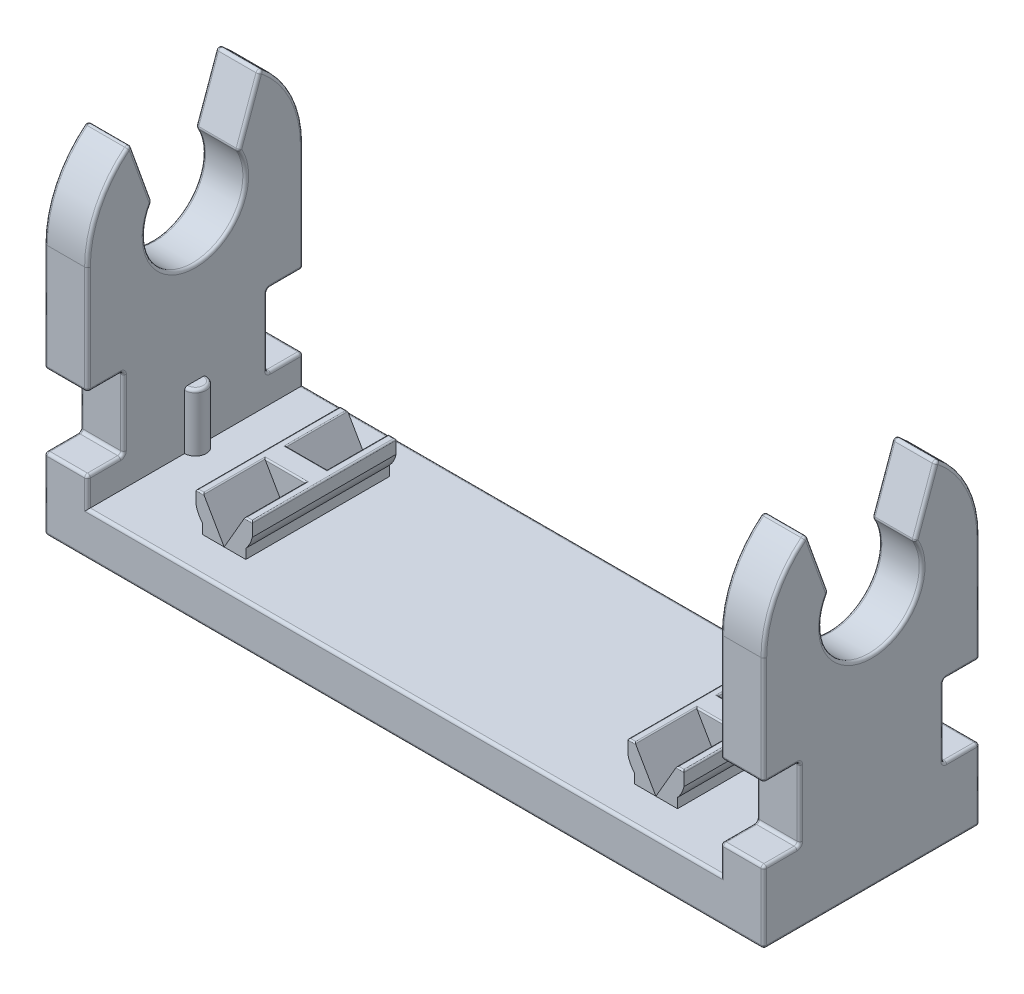
from build123d import *

# Parameters (mm, degrees)
EXTRUDE_1_DEPTH                 = 50
CUT_EXTRUDE_1_REACH             = 57.754
SKETCH_2_W                      = 44
SKETCH_2_H                      = 22
CUT_EXTRUDE_1_DIRECTION_2_REACH = 57.754
EXTRUDE_2_DEPTH                 = 2
PATTERN_LINEAR_1_COUNT          = 2
PATTERN_LINEAR_1_PITCH          = 15
PATTERN_LINEAR_1_COL_COUNT      = 2
PATTERN_LINEAR_1_COL_PITCH      = 15
CUT_EXTRUDE_2_DEPTH             = 50
EXTRUDE_3_DEPTH                 = 5
SKETCH_6_W                      = 2.886751346
SKETCH_6_H                      = 1.5
EXTRUDE_4_DEPTH                 = 2.5
SKETCH_7_R                      = 0.75
EXTRUDE_5_DEPTH                 = 4
PATTERN_LINEAR_2_COUNT          = 2
PATTERN_LINEAR_2_PITCH          = 30
PATTERN_LINEAR_2_COPY_1_DEPTH   = 5
FILLET_1_R                      = 0.1
FILLET_2_R                      = 0.2
FILLET_3_R                      = 0.2
FILLET_4_R                      = 0.1


with BuildPart() as part:
    # 草图1 → 凸台-拉伸1 (new body)
    with BuildSketch(Plane(origin=(0, 0, 0), x_dir=(0, 0, -1), z_dir=(1, 0, 0))):
        with BuildLine():
            Line((7.5, 0), (-7.5, 0))
            Line((-7.5, 0), (-7.5, 5))
            Line((-7.5, 5), (-5, 5))
            Line((-5, 5), (-5, 10))
            Line((-5, 10), (-7.5, 10))
            Line((-7.5, 10), (-7.5, 17.5))
            ThreePointArc((-7.5, 17.5), (-6.708203932, 20.854101966), (-4.5, 23.5))
            Line((-4.5, 23.5), (-3, 19.302775638))
            ThreePointArc((-3, 19.302775638), (0, 14), (3, 19.302775638))
            Line((3, 19.302775638), (4.5, 23.5))
            ThreePointArc((4.5, 23.5), (6.708203932, 20.854101966), (7.5, 17.5))
            Line((7.5, 17.5), (7.5, 10))
            Line((7.5, 10), (5, 10))
            Line((5, 10), (5, 5))
            Line((5, 5), (7.5, 5))
            Line((7.5, 5), (7.5, 0))
        make_face()
    extrude(amount=EXTRUDE_1_DEPTH)

    # 草图2 → 切除-拉伸1 (cut, up to next)
    with BuildSketch(Plane.XY, mode=Mode.PRIVATE) as cut_extrude_1_sk1:
        with Locations((25, 14)):
            Rectangle(SKETCH_2_W, SKETCH_2_H)
    cut_extrude_1_tool1 = extrude(cut_extrude_1_sk1.sketch, amount=-CUT_EXTRUDE_1_REACH, mode=Mode.PRIVATE) & part.part
    add(cut_extrude_1_tool1.solids().sort_by_distance((25, 14, 0))[0], mode=Mode.SUBTRACT)

    # 草图2 → 切除-拉伸1 direction 2 (cut, up to next)
    with BuildSketch(Plane.XY, mode=Mode.PRIVATE) as cut_extrude_1_direction_2_sk1:
        with Locations((25, 14)):
            Rectangle(SKETCH_2_W, SKETCH_2_H)
    cut_extrude_1_direction_2_tool1 = extrude(cut_extrude_1_direction_2_sk1.sketch, amount=CUT_EXTRUDE_1_DIRECTION_2_REACH, mode=Mode.PRIVATE) & part.part
    add(cut_extrude_1_direction_2_tool1.solids().sort_by_distance((25, 14, 0))[0], mode=Mode.SUBTRACT)

    # 草图3 → 凸台-拉伸2 (add, symmetric)
    with BuildSketch(Plane.XY):
        with BuildLine():
            Line((26.5, 0), (23.5, 0))
            Line((23.5, 0), (23.5, -0.677124344))
            ThreePointArc((23.5, -0.677124344), (23.219957697, -1.088161527), (23.05, -1.555590279))
            Line((23.05, -1.555590279), (23.05, -2.5))
            Line((23.05, -2.5), (26.95, -2.5))
            Line((26.95, -2.5), (26.95, -1.555590279))
            ThreePointArc((26.95, -1.555590279), (26.780042303, -1.088161527), (26.5, -0.677124344))
            Line((26.5, -0.677124344), (26.5, 0))
        make_face()
    extrude_2 = extrude(amount=EXTRUDE_2_DEPTH, both=True)

    # 阵列(线性)1: 凸台-拉伸2 ×2
    with Locations(*[(-i * PATTERN_LINEAR_1_PITCH, 0, 0) for i in range(1, PATTERN_LINEAR_1_COUNT)]):
        add(extrude_2)

    # 阵列(线性)1 col: 凸台-拉伸2 ×2
    with Locations(*[(i * PATTERN_LINEAR_1_COL_PITCH, 0, 0) for i in range(1, PATTERN_LINEAR_1_COL_COUNT)]):
        add(extrude_2)

    # 草图4 → 切除-拉伸2 (cut)
    with BuildSketch(Plane.ZY):
        with BuildLine():
            Line((1.5, 0), (1.5, -0.677124344))
            ThreePointArc((1.5, -0.677124344), (1.780042303, -1.088161527), (1.95, -1.555590279))
            Line((1.95, -1.555590279), (1.95, -2.5))
            Line((1.95, -2.5), (2, -2.5))
            Line((2, -2.5), (2, 0))
            Line((2, 0), (1.5, 0))
        make_face()
        with BuildLine():
            Line((-2, -2.5), (-1.95, -2.5))
            Line((-1.95, -2.5), (-1.95, -1.555590279))
            ThreePointArc((-1.95, -1.555590279), (-1.780042303, -1.088161527), (-1.5, -0.677124344))
            Line((-1.5, -0.677124344), (-1.5, 0))
            Line((-1.5, 0), (-2, 0))
            Line((-2, 0), (-2, -2.5))
        make_face()
    extrude(amount=-CUT_EXTRUDE_2_DEPTH, mode=Mode.SUBTRACT)

    # 草图5 → 凸台-拉伸3 (add, symmetric)
    with BuildSketch(Plane.XY):
        with BuildLine():
            Line((10, 3), (8.5, 3))
            Line((8.5, 3), (8.5, 3.677124344))
            ThreePointArc((8.5, 3.677124344), (8.219957697, 4.088161527), (8.05, 4.555590279))
            Line((8.05, 4.555590279), (8.05, 5.5))
            Line((8.05, 5.5), (8.556624327, 5.5))
            Line((8.556624327, 5.5), (10, 3))
        make_face()
    extrude_3 = extrude(amount=EXTRUDE_3_DEPTH, both=True)

    # 镜向1: 凸台-拉伸3 across plane
    add(extrude_3.mirror(Plane(origin=(10, 0, 0), x_dir=(0, 0, 1), z_dir=(1, 0, 0))))

    # 草图6 → 凸台-拉伸4 (add)
    with BuildSketch(Plane(origin=(0, 5.5, 0), x_dir=(1, 0, 0), z_dir=(0, 1, 0))):
        with Locations((10, 0)):
            Rectangle(SKETCH_6_W, SKETCH_6_H)
    extrude_4 = extrude(amount=-EXTRUDE_4_DEPTH)

    # 草图7 → 凸台-拉伸5 (add)
    with BuildSketch(Plane(origin=(0, 3, 0), x_dir=(1, 0, 0), z_dir=(0, 1, 0))):
        with Locations((3, 0)):
            Circle(SKETCH_7_R)
    extrude_5 = extrude(amount=EXTRUDE_5_DEPTH)

    # 阵列(线性)2: 凸台-拉伸3, 凸台-拉伸4 ×2
    with Locations(*[(i * PATTERN_LINEAR_2_PITCH, 0, 0) for i in range(1, PATTERN_LINEAR_2_COUNT)]):
        add(extrude_3)
        add(extrude_4)

    # 阵列(线性)2 copy 1 sketch → 阵列(线性)2 copy 1 (add, symmetric)
    with BuildSketch(Plane(origin=(50, 0, 0), x_dir=(-1, 0, 0), z_dir=(0, 0, 1))):
        with BuildLine():
            Line((10, -3), (8.5, -3))
            Line((8.5, -3), (8.5, -3.677124344))
            ThreePointArc((8.5, -3.677124344), (8.219957697, -4.088161527), (8.05, -4.555590279))
            Line((8.05, -4.555590279), (8.05, -5.5))
            Line((8.05, -5.5), (8.556624327, -5.5))
            Line((8.556624327, -5.5), (10, -3))
        make_face()
    extrude(amount=PATTERN_LINEAR_2_COPY_1_DEPTH, both=True)

    # 镜向2: 凸台-拉伸5 across plane
    add(extrude_5.mirror(Plane.ZY.offset(-25)))

    # 圆角1
    fillet_1_edges = [part.edges().sort_by_distance(p)[0] for p in [
        (8.05, -2.5, 0),
        (11.95, -2.5, 0),
        (38.05, -2.5, 0),
        (41.95, -2.5, 0),
        (23.05, -2.5, 0),
        (26.95, -2.5, 0),
        (25, -2.5, -1.95),
        (40, -2.5, -1.95),
        (10, -2.5, -1.95),
        (25, -2.5, 1.95),
        (40, -2.5, 1.95),
        (10, -2.5, 1.95),
    ]]
    fillet(fillet_1_edges, radius=FILLET_1_R)

    # 圆角2
    fillet_2_edges = [part.edges().sort_by_distance(p)[0] for p in [
        (50, 7.5, -5),
        (50, 10, -6.25),
        (0, 0, 0),
        (0, 2.5, 7.5),
        (0, 5, 6.25),
        (0, 7.5, 5),
        (0, 10, 6.25),
        (50, 13.75, -7.5),
        (0, 13.75, 7.5),
        (0, 20.854101966, 6.708203932),
        (0, 21.401387819, 3.75),
        (0, 14, 0),
        (0, 21.401387819, -3.75),
        (0, 20.854101966, -6.708203932),
        (0, 13.75, -7.5),
        (0, 10, -6.25),
        (50, 20.854101966, -6.708203932),
        (0, 7.5, -5),
        (0, 5, -6.25),
        (0, 2.5, -7.5),
        (50, 21.401387819, -3.75),
        (50, 14, 0),
        (25, 0, -7.5),
        (25, 0, 7.5),
        (48.5, 5, 7.5),
        (48.5, 5, 5),
        (48.5, 10, 5),
        (48.5, 10, 7.5),
        (48.5, 23.5, 4.5),
        (48.5, 19.302775638, 3),
        (48.5, 19.302775638, -3),
        (48.5, 23.5, -4.5),
        (48.5, 10, -7.5),
        (48.5, 10, -5),
        (48.5, 5, -5),
        (48.5, 5, -7.5),
        (50, 21.401387819, 3.75),
        (50, 20.854101966, 6.708203932),
        (50, 13.75, 7.5),
        (50, 10, 6.25),
        (50, 2.5, -7.5),
        (50, 7.5, 5),
        (50, 5, 6.25),
        (1.5, 5, 7.5),
        (1.5, 5, 5),
        (50, 2.5, 7.5),
        (1.5, 10, 5),
        (1.5, 10, 7.5),
        (50, 0, 0),
        (1.5, 23.5, 4.5),
        (1.5, 19.302775638, 3),
        (1.5, 19.302775638, -3),
        (1.5, 23.5, -4.5),
        (1.5, 10, -7.5),
        (1.5, 10, -5),
        (1.5, 5, -5),
        (1.5, 5, -7.5),
        (3, 21.401387819, 3.75),
        (3, 14, 0),
        (3, 4, 7.5),
        (3, 5, 6.25),
        (3, 7.5, 5),
        (3, 10, 6.25),
        (3, 13.75, 7.5),
        (3, 20.854101966, 6.708203932),
        (25, 3, 7.5),
        (47, 14, 0),
        (47, 21.401387819, 3.75),
        (47, 20.854101966, 6.708203932),
        (47, 13.75, 7.5),
        (47, 10, 6.25),
        (47, 7.5, 5),
        (47, 5, 6.25),
        (47, 4, 7.5),
        (50, 5, -6.25),
        (25, 3, -7.5),
        (3, 4, -7.5),
        (47, 4, -7.5),
        (3, 5, -6.25),
        (47, 5, -6.25),
        (3, 7.5, -5),
        (47, 7.5, -5),
        (3, 10, -6.25),
        (47, 10, -6.25),
        (3, 13.75, -7.5),
        (47, 13.75, -7.5),
        (3, 20.854101966, -6.708203932),
        (47, 20.854101966, -6.708203932),
        (3, 21.401387819, -3.75),
        (47, 21.401387819, -3.75),
    ]]
    fillet(fillet_2_edges, radius=FILLET_2_R)

    # 圆角3
    fillet_3_edges = [part.edges().sort_by_distance(p)[0] for p in [
        (3.75, 7, 0),
        (46.25, 7, 0),
    ]]
    fillet(fillet_3_edges, radius=FILLET_3_R)

    # 圆角4
    fillet_4_edges = [part.edges().sort_by_distance(p)[0] for p in [
        (8.556624327, 5.5, -2.875),
        (8.05, 5.5, 0),
        (8.303312164, 5.5, -5),
        (8.303312164, 5.5, 5),
        (11.443375673, 5.5, -2.875),
        (11.696687836, 5.5, 5),
        (11.95, 5.5, 0),
        (11.696687836, 5.5, -5),
        (11.443375673, 5.5, 2.875),
        (8.556624327, 5.5, 2.875),
        (10, 5.5, 0.75),
        (10, 5.5, -0.75),
        (38.556624327, 5.5, -2.875),
        (38.05, 5.5, 0),
        (38.303312164, 5.5, -5),
        (38.303312164, 5.5, 5),
        (41.443375673, 5.5, -2.875),
        (41.696687836, 5.5, 5),
        (41.95, 5.5, 0),
        (41.696687836, 5.5, -5),
        (41.443375673, 5.5, 2.875),
        (38.556624327, 5.5, 2.875),
        (40, 5.5, 0.75),
        (40, 5.5, -0.75),
    ]]
    fillet(fillet_4_edges, radius=FILLET_4_R)


solid = part.part
